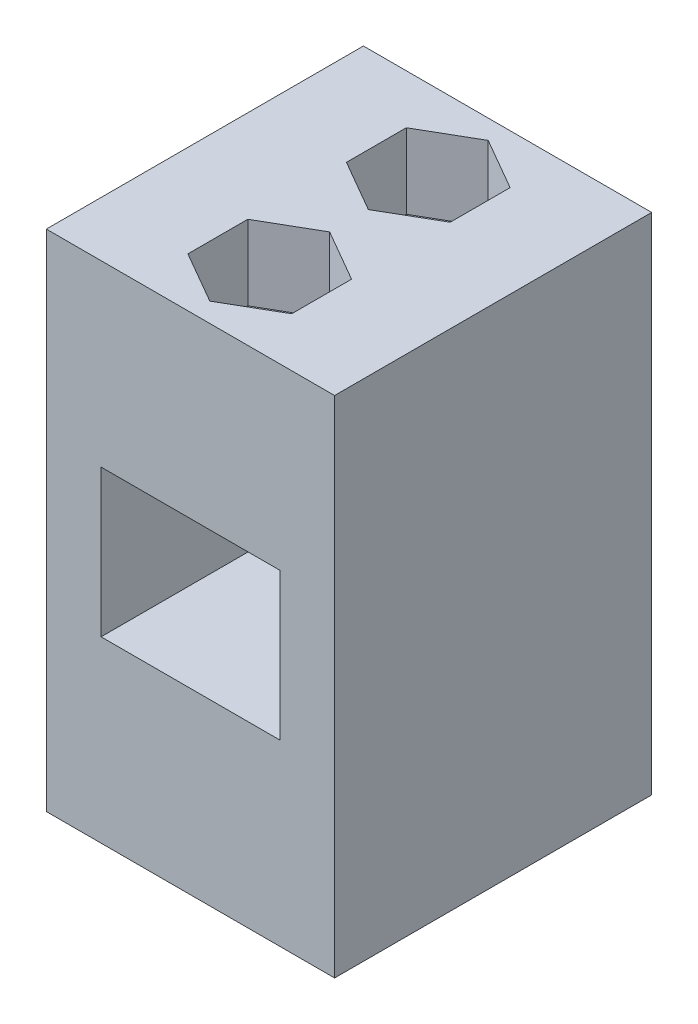
from build123d import *

# Parameters (mm, degrees)
BOSS_EXTRUDE1_DEPTH                      = 10
BOSS_EXTRUDE1_DEPTH_BACK                 = 10
SKETCH1_W                                = 22
SKETCH1_H                                = 35
CUT_EXTRUDE1_DEPTH                       = 30.837057496
CUT_EXTRUDE1_DEPTH_BACK                  = 30.837057496
SKETCH2_W                                = 12.4
SKETCH2_H                                = 10.2
CUT_EXTRUDE2_DEPTH                       = 5.2
MIRROR1_AT_THE_SECOND_PLANE_COPY_1_DEPTH = 5.2


with BuildPart() as part:
    # Sketch1 → Boss-Extrude1 (new, two sides: drawn at the far end of the back side and taken through both)
    with BuildSketch(Plane(origin=(0, 0, 0), x_dir=(0, 0, -1), z_dir=(1, 0, 0)).offset(-BOSS_EXTRUDE1_DEPTH_BACK)):
        Rectangle(SKETCH1_W, SKETCH1_H)
    extrude(amount=BOSS_EXTRUDE1_DEPTH + BOSS_EXTRUDE1_DEPTH_BACK)

    # Sketch2 → Cut-Extrude1 (cut, two sides: drawn at the far end of the back side and taken through both)
    with BuildSketch(Plane.XY.offset(11).offset(-CUT_EXTRUDE1_DEPTH_BACK)):
        Rectangle(SKETCH2_W, SKETCH2_H)
    extrude(amount=CUT_EXTRUDE1_DEPTH + CUT_EXTRUDE1_DEPTH_BACK, mode=Mode.SUBTRACT)

    # Sketch3 → Cut-Extrude2 (cut)
    with BuildSketch(Plane(origin=(0, 17.5, 0), x_dir=(1, 0, 0), z_dir=(0, 1, 0))):
        Polygon((3.6, 7.578460969), (0, 9.656921938), (-3.6, 7.578460969), (-3.6, 3.421539031), (0, 1.343078062), (3.6, 3.421539031), align=None)
    cut_extrude2 = extrude(amount=-CUT_EXTRUDE2_DEPTH, mode=Mode.SUBTRACT)

    # Mirror1: Cut-Extrude2 across plane
    add(cut_extrude2.mirror(Plane.ZX), mode=Mode.SUBTRACT)

    # Mirror1 at the second plane: Cut-Extrude2 across plane
    add(cut_extrude2.mirror(Plane.XY), mode=Mode.SUBTRACT)

    # Mirror1 at the second plane copy 1 sketc → Mirror1 at the second plane copy 1 (cut)
    with BuildSketch(Plane.XZ.offset(17.5)):
        Polygon((3.6, 7.578460969), (0, 9.656921938), (-3.6, 7.578460969), (-3.6, 3.421539031), (0, 1.343078062), (3.6, 3.421539031), align=None)
    extrude(amount=-MIRROR1_AT_THE_SECOND_PLANE_COPY_1_DEPTH, mode=Mode.SUBTRACT)


solid = part.part
